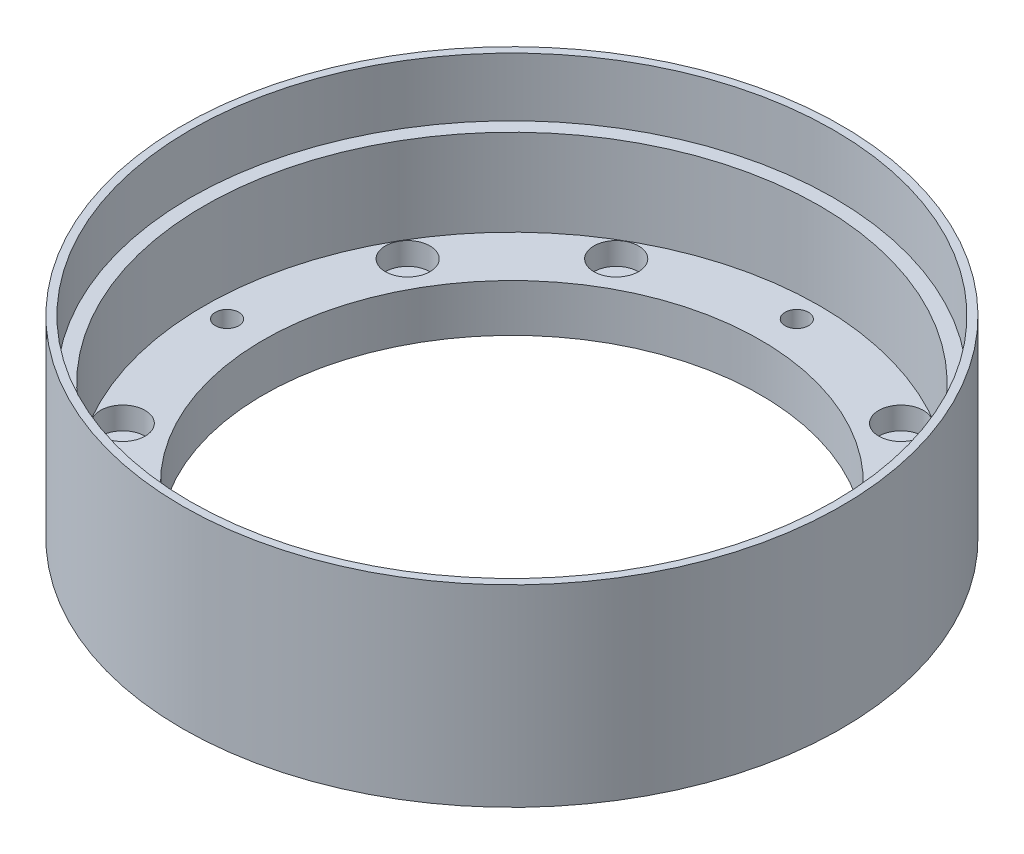
from build123d import *

# Parameters (mm, degrees)
SKETCH_1_R          = 59
EXTRUDE_1_DEPTH     = 34.5
SKETCH_2_R          = 57.6
CUT_EXTRUDE_1_DEPTH = 10.5
SKETCH_3_R          = 55.1
CUT_EXTRUDE_2_DEPTH = 15.5
SKETCH_4_R          = 44.5
CUT_EXTRUDE_3_DEPTH = 88.395652066
SKETCH_9_R          = 4
CUT_EXTRUDE_7_DEPTH = 4
SKETCH_10_R         = 2.1
CUT_EXTRUDE_8_DEPTH = 88.395652066
SKETCH_11_R         = 3.75
CUT_EXTRUDE_9_DEPTH = 5


with BuildPart() as part:
    # 草图1 → 凸台-拉伸1 (new body)
    with BuildSketch(Plane(origin=(0, 0, 0), x_dir=(1, 0, 0), z_dir=(0, 1, 0))):
        with Locations(Location((0, 0, 0), (0, 0, 270))):
            Circle(SKETCH_1_R)
    extrude(amount=EXTRUDE_1_DEPTH)

    # 草图2 → 切除-拉伸1 (cut)
    with BuildSketch(Plane(origin=(0, 34.5, 0), x_dir=(1, 0, 0), z_dir=(0, 1, 0))):
        with Locations(Location((0, 0, 0), (0, 0, 270))):
            Circle(SKETCH_2_R)
    extrude(amount=-CUT_EXTRUDE_1_DEPTH, mode=Mode.SUBTRACT)

    # 草图3 → 切除-拉伸2 (cut)
    with BuildSketch(Plane(origin=(0, 24, 0), x_dir=(1, 0, 0), z_dir=(0, 1, 0))):
        with Locations(Location((0, 0, 0), (0, 0, 270))):
            Circle(SKETCH_3_R)
    extrude(amount=-CUT_EXTRUDE_2_DEPTH, mode=Mode.SUBTRACT)

    # 草图4 → 切除-拉伸3 (cut, through all)
    with BuildSketch(Plane(origin=(0, 8.5, 0), x_dir=(1, 0, 0), z_dir=(0, 1, 0))):
        with Locations(Location((0, 0, 0), (0, 0, 270))):
            Circle(SKETCH_4_R)
    extrude(amount=-CUT_EXTRUDE_3_DEPTH, mode=Mode.SUBTRACT)

    # 草图9 → 切除-拉伸7 (cut)
    with BuildSketch(Plane(origin=(0, 8.5, 0), x_dir=(1, 0, 0), z_dir=(0, 1, 0))):
        with Locations(Location((-44.167295593, 25.5, 0), (0, 0, 270))):
            Circle(SKETCH_9_R)
        with Locations(Location((-25.5, 44.167295593, 0), (0, 0, 270))):
            Circle(SKETCH_9_R)
        with Locations(Location((25.5, 44.167295593, 0), (0, 0, 270))):
            Circle(SKETCH_9_R)
        with Locations(Location((44.167295593, 25.5, 0), (0, 0, 270))):
            Circle(SKETCH_9_R)
        with Locations(Location((44.167295593, -25.5, 0), (0, 0, 270))):
            Circle(SKETCH_9_R)
        with Locations(Location((25.5, -44.167295593, 0), (0, 0, 270))):
            Circle(SKETCH_9_R)
        with Locations(Location((-25.5, -44.167295593, 0), (0, 0, 270))):
            Circle(SKETCH_9_R)
        with Locations(Location((-44.167295593, -25.5, 0), (0, 0, 270))):
            Circle(SKETCH_9_R)
    extrude(amount=-CUT_EXTRUDE_7_DEPTH, mode=Mode.SUBTRACT)

    # 草图10 → 切除-拉伸8 (cut, through all)
    with BuildSketch(Plane(origin=(0, 8.5, 0), x_dir=(1, 0, 0), z_dir=(0, 1, 0))):
        with Locations(Location((0, 51, 0), (0, 0, 270))):
            Circle(SKETCH_10_R)
        with Locations(Location((51, 0, 0), (0, 0, 270))):
            Circle(SKETCH_10_R)
        with Locations(Location((0, -51, 0), (0, 0, 270))):
            Circle(SKETCH_10_R)
        with Locations(Location((-51, 0, 0), (0, 0, 270))):
            Circle(SKETCH_10_R)
    extrude(amount=-CUT_EXTRUDE_8_DEPTH, mode=Mode.SUBTRACT)

    # 草图11 → 切除-拉伸9 (cut)
    with BuildSketch(Plane.XZ):
        with Locations(Location((0, 51, 0), (0, 0, 270))):
            Circle(SKETCH_11_R)
        with Locations(Location((51, 0, 0), (0, 0, 270))):
            Circle(SKETCH_11_R)
        with Locations(Location((0, -51, 0), (0, 0, 270))):
            Circle(SKETCH_11_R)
        with Locations(Location((-51, 0, 0), (0, 0, 270))):
            Circle(SKETCH_11_R)
    extrude(amount=-CUT_EXTRUDE_9_DEPTH, mode=Mode.SUBTRACT)


solid = part.part
